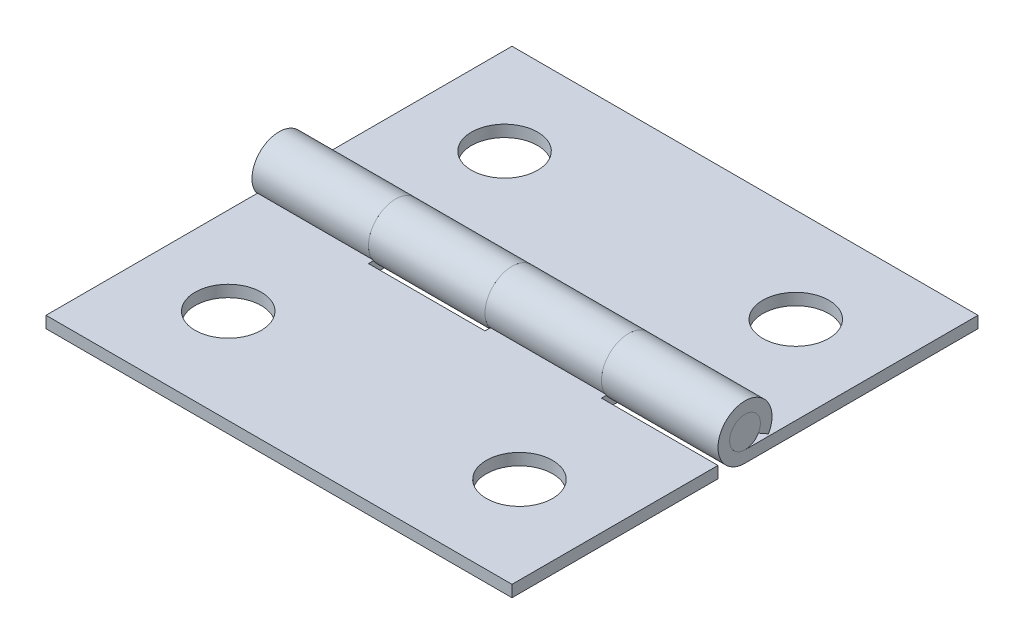
from build123d import *

# Parameters (mm, degrees)
BOSS_EXTRUDE1_DEPTH = 12.7
SKETCH4_W           = 6.35
SKETCH4_H           = 2.9464
CUT_EXTRUDE1_DEPTH  = 19.020830121
LPATTERN1_COUNT     = 6
LPATTERN1_PITCH     = 12.7
SKETCH5_R           = 1.8034
CUT_EXTRUDE2_DEPTH  = 19.108632471
CIRPATTERN1_COUNT   = 2
SKETCH6_R           = 0.8382
BOSS_EXTRUDE2_DEPTH = 12.7


with BuildPart() as part:
    # Sketch3 → Boss-Extrude1 (new, symmetric)
    with BuildSketch(Plane(origin=(0, 0, 0), x_dir=(0, 0, -1), z_dir=(1, 0, 0))):
        with BuildLine():
            Line((0, -1.4732), (-12.7, -1.4732))
            Line((-12.7, -1.4732), (-12.7, -0.8382))
            Line((-12.7, -0.8382), (0, -0.8382))
            ThreePointArc((0, -0.8382), (0.421388638, 0.724576328), (-0.728533124, -0.414510226))
            Line((-0.728533124, -0.414510226), (-1.280452157, -0.728533124))
            ThreePointArc((-1.280452157, -0.728533124), (0.740622455, 1.273497789), (0, -1.4732))
        make_face()
    extrude(amount=BOSS_EXTRUDE1_DEPTH, both=True)

    # Sketch4 → Cut-Extrude1 (cut, symmetric)
    with BuildSketch(Plane(origin=(0, 0, 0), x_dir=(1, 0, 0), z_dir=(0, 1, 0))):
        with Locations((-3.175, 0)):
            Rectangle(SKETCH4_W, SKETCH4_H)
    cut_extrude1 = extrude(amount=CUT_EXTRUDE1_DEPTH, both=True, mode=Mode.SUBTRACT)

    # LPattern1: Cut-Extrude1 ×6
    with Locations(*[(i * LPATTERN1_PITCH, 0, 0) for i in range(1, LPATTERN1_COUNT)]):
        add(cut_extrude1, mode=Mode.SUBTRACT)

    # Sketch5 → Cut-Extrude2 (cut, through all)
    with BuildSketch(Plane(origin=(0, -0.8382, 0), x_dir=(1, 0, 0), z_dir=(0, 1, 0))):
        with Locations(Location((7.9502, -7.5438, 0), (0, 0, 270))):
            Circle(SKETCH5_R)
        with Locations(Location((-7.9248, -7.5438, 0), (0, 0, 270))):
            Circle(SKETCH5_R)
    extrude(amount=-CUT_EXTRUDE2_DEPTH, mode=Mode.SUBTRACT)


with BuildPart() as cirpattern1_1:
    # CirPattern1: pattern copy
    add(part.part.rotate(Axis((0, 0, 0), (0, 1, 0)), 1 * 360 / CIRPATTERN1_COUNT))


with BuildPart() as body_3:
    # Sketch6 → Boss-Extrude2 (new, symmetric)
    with BuildSketch(Plane(origin=(0, 0, 0), x_dir=(0, 0, -1), z_dir=(1, 0, 0))):
        Circle(SKETCH6_R)
    extrude(amount=BOSS_EXTRUDE2_DEPTH, both=True)


solid = Compound([part.part, cirpattern1_1.part, body_3.part])
